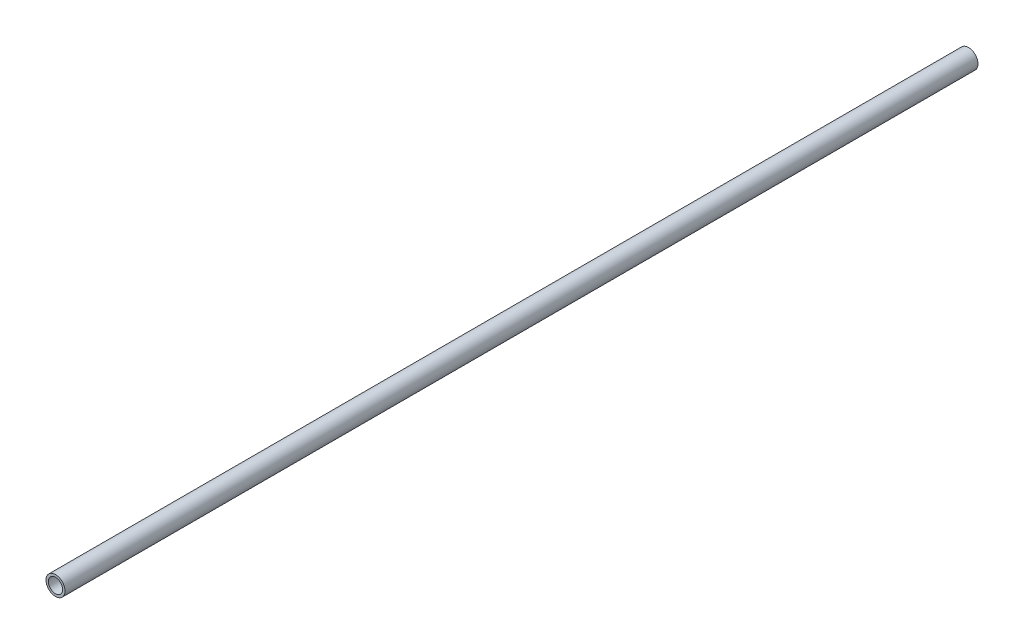
from build123d import *

# Parameters (mm, degrees)
SKETCH1_R           = 9.525
SKETCH1_R_2         = 7.14375
BOSS_EXTRUDE1_DEPTH = 914.4


with BuildPart() as part:
    # Sketch1 → Boss-Extrude1 (new body)
    with BuildSketch(Plane.XY):
        Circle(SKETCH1_R)
        Circle(SKETCH1_R_2, mode=Mode.SUBTRACT)
    extrude(amount=BOSS_EXTRUDE1_DEPTH)


solid = part.part
